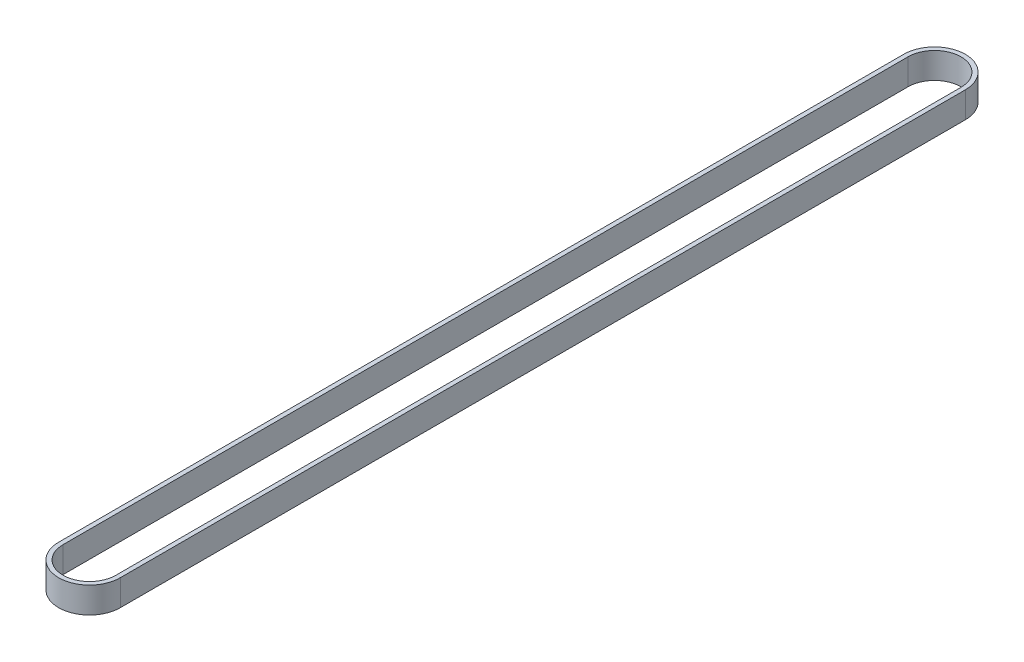
from build123d import *

# Parameters (mm, degrees)
EXTRUDE_1_DEPTH = 6


with BuildPart() as part:
    # 草图1 → 凸台-拉伸1 (new body)
    with BuildSketch(Plane(origin=(0, 0, 0), x_dir=(1, 0, 0), z_dir=(0, 1, 0))):
        with BuildLine():
            Line((-7.11, -97.55), (-7.11, 97.55))
            ThreePointArc((-7.11, 97.55), (0, 104.66), (7.11, 97.55))
            Line((7.11, 97.55), (7.11, -97.55))
            ThreePointArc((7.11, -97.55), (0, -104.66), (-7.11, -97.55))
        make_face()
        with BuildLine():
            Line((-6.11, -97.55), (-6.11, 97.55))
            ThreePointArc((-6.11, 97.55), (0, 103.66), (6.11, 97.55))
            Line((6.11, 97.55), (6.11, -97.55))
            ThreePointArc((6.11, -97.55), (0, -103.66), (-6.11, -97.55))
        make_face(mode=Mode.SUBTRACT)
    extrude(amount=EXTRUDE_1_DEPTH)


solid = part.part
